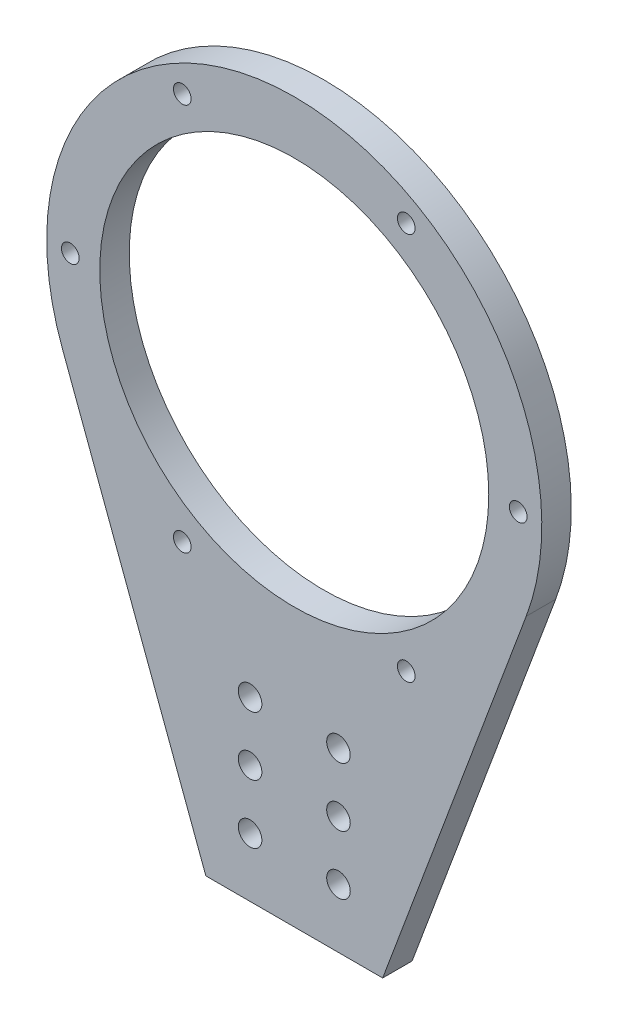
from build123d import *

# Parameters (mm, degrees)
SKETCH1_R           = 42
SKETCH1_R_2         = 33
BOSS_EXTRUDE1_DEPTH = 5
SKETCH9_R           = 1.5
CUT_EXTRUDE5_DEPTH  = 7
SKETCH10_R          = 2
CUT_EXTRUDE6_DEPTH  = 7


with BuildPart() as part:
    # Sketch1 → Boss-Extrude1 (new body)
    # profile 1 of 2: a face of its own
    with BuildSketch(Plane.XY):
        Circle(SKETCH1_R)
        Circle(SKETCH1_R_2, mode=Mode.SUBTRACT)
    # profile 2 of 2: a face of its own
    with BuildSketch(Plane.XY):
        with BuildLine():
            Line((-15, -80), (15, -80))
            Line((15, -80), (39.354283789, -14.67107179))
            ThreePointArc((39.354283789, -14.67107179), (0, -42), (-39.354283789, -14.67107179))
            Line((-39.354283789, -14.67107179), (-15, -80))
        make_face()
    extrude(amount=BOSS_EXTRUDE1_DEPTH)

    # Sketch9 → Cut-Extrude5 (cut)
    with BuildSketch(Plane.XY.offset(5)):
        with Locations((19, 32.908965344)):
            Circle(SKETCH9_R)
        with Locations((38, 0)):
            Circle(SKETCH9_R)
        with Locations((19, -32.908965344)):
            Circle(SKETCH9_R)
        with Locations((-19, -32.908965344)):
            Circle(SKETCH9_R)
        with Locations((-38, 0)):
            Circle(SKETCH9_R)
        with Locations((-19, 32.908965344)):
            Circle(SKETCH9_R)
    extrude(amount=-CUT_EXTRUDE5_DEPTH, mode=Mode.SUBTRACT)

    # Sketch10 → Cut-Extrude6 (cut)
    with BuildSketch(Plane.XY.offset(5)):
        with Locations((7.5, -60)):
            Circle(SKETCH10_R)
        with Locations((7.5, -70)):
            Circle(SKETCH10_R)
        with Locations((-7.5, -70)):
            Circle(SKETCH10_R)
        with Locations((-7.5, -60)):
            Circle(SKETCH10_R)
        with Locations((-7.5, -50)):
            Circle(SKETCH10_R)
        with Locations((7.5, -50)):
            Circle(SKETCH10_R)
    extrude(amount=-CUT_EXTRUDE6_DEPTH, mode=Mode.SUBTRACT)


solid = part.part
